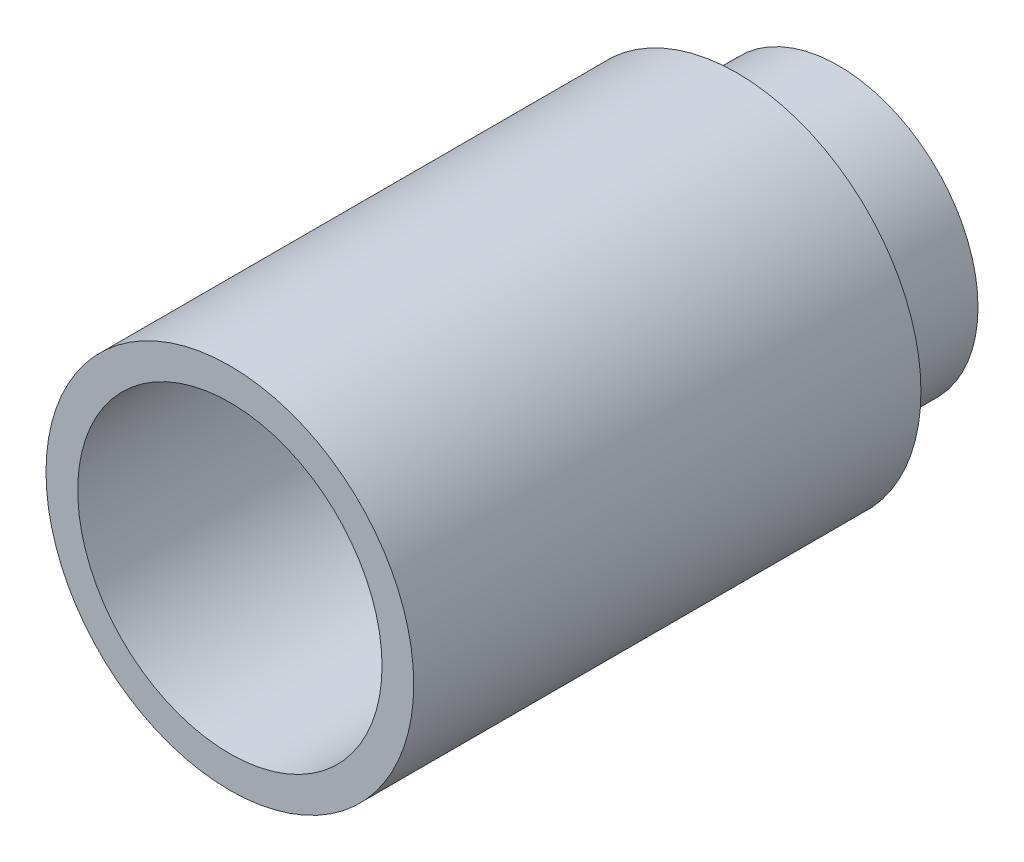
from build123d import *

# Parameters (mm, degrees)
SKETCH_1_R          = 14.5
EXTRUDE_1_DEPTH     = 40
SKETCH_2_R          = 12
CUT_EXTRUDE_1_DEPTH = 32
SKETCH_3_R          = 11
EXTRUDE_2_DEPTH     = 8
SKETCH_4_R          = 9.5
CUT_EXTRUDE_2_DEPTH = 6
CUT_EXTRUDE_START   = -6
SKETCH_5_R          = 9.5
CUT_EXTRUDE_3_DEPTH = 6
SKETCH_6_R          = 3.5
CUT_EXTRUDE_4_DEPTH = 6


with BuildPart() as part:
    # 스케치1 → 돌출1 (new body)
    with BuildSketch(Plane.XY):
        Circle(SKETCH_1_R)
    extrude(amount=EXTRUDE_1_DEPTH)

    # 스케치2 → 컷-돌출1 (cut)
    with BuildSketch(Plane.XY.offset(40)):
        Circle(SKETCH_2_R)
    extrude(amount=-CUT_EXTRUDE_1_DEPTH, mode=Mode.SUBTRACT)

    # 스케치3 → 돌출2 (add)
    with BuildSketch(Plane(origin=(0, 0, 0), x_dir=(-1, 0, 0), z_dir=(0, 0, -1))):
        with Locations(Location((0, 0, 0), (0, 0, 180))):
            Circle(SKETCH_3_R)
    extrude(amount=EXTRUDE_2_DEPTH)

    # 스케치4 → 컷-돌출2 (cut)
    with BuildSketch(Plane.XY.offset(8)):
        Circle(SKETCH_4_R)
    extrude(amount=-CUT_EXTRUDE_2_DEPTH, mode=Mode.SUBTRACT)

    # 스케치5 → 컷-돌출3 (cut)
    with BuildSketch(Plane(origin=(0, 0, -8), x_dir=(-1, 0, 0), z_dir=(0, 0, -1)).offset(CUT_EXTRUDE_START)):
        with Locations(Location((0, 0, 0), (0, 0, 180))):
            Circle(SKETCH_5_R)
    extrude(amount=CUT_EXTRUDE_3_DEPTH, mode=Mode.SUBTRACT)

    # 스케치6 → 컷-돌출4 (cut)
    with BuildSketch(Plane(origin=(0, 0, -2), x_dir=(-1, 0, 0), z_dir=(0, 0, -1))):
        Circle(SKETCH_6_R)
    extrude(amount=-CUT_EXTRUDE_4_DEPTH, mode=Mode.SUBTRACT)


solid = part.part
